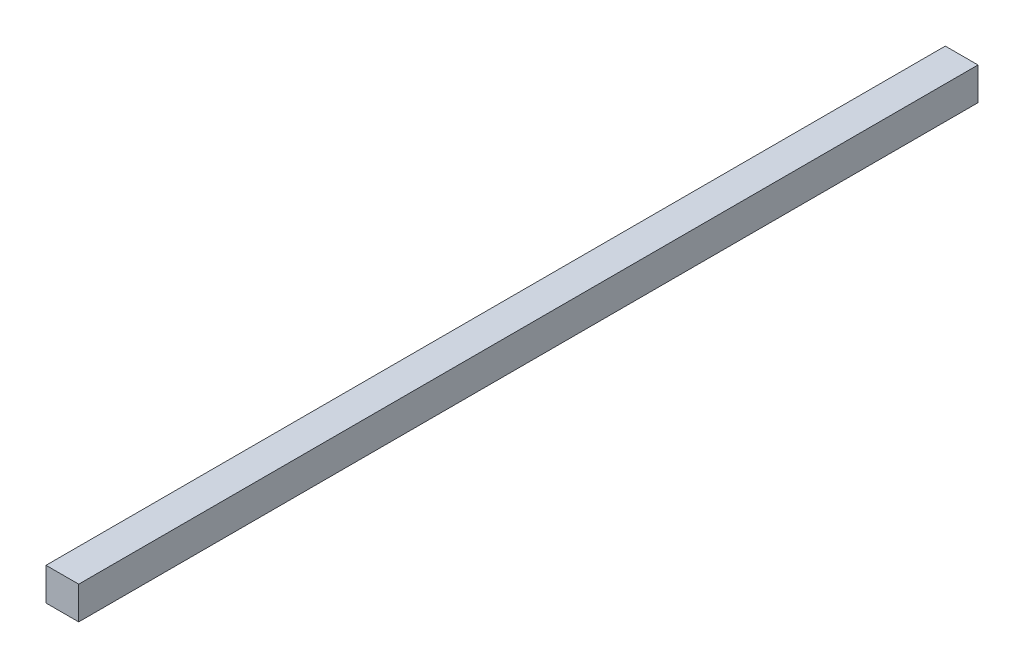
from build123d import *

# Parameters (mm, degrees)
SKETCH1_W           = 20
SKETCH1_H           = 20
BOSS_EXTRUDE1_DEPTH = 550


with BuildPart() as part:
    # Sketch1 → Boss-Extrude1 (new body)
    with BuildSketch(Plane.XY):
        Rectangle(SKETCH1_W, SKETCH1_H)
    extrude(amount=BOSS_EXTRUDE1_DEPTH)


solid = part.part
